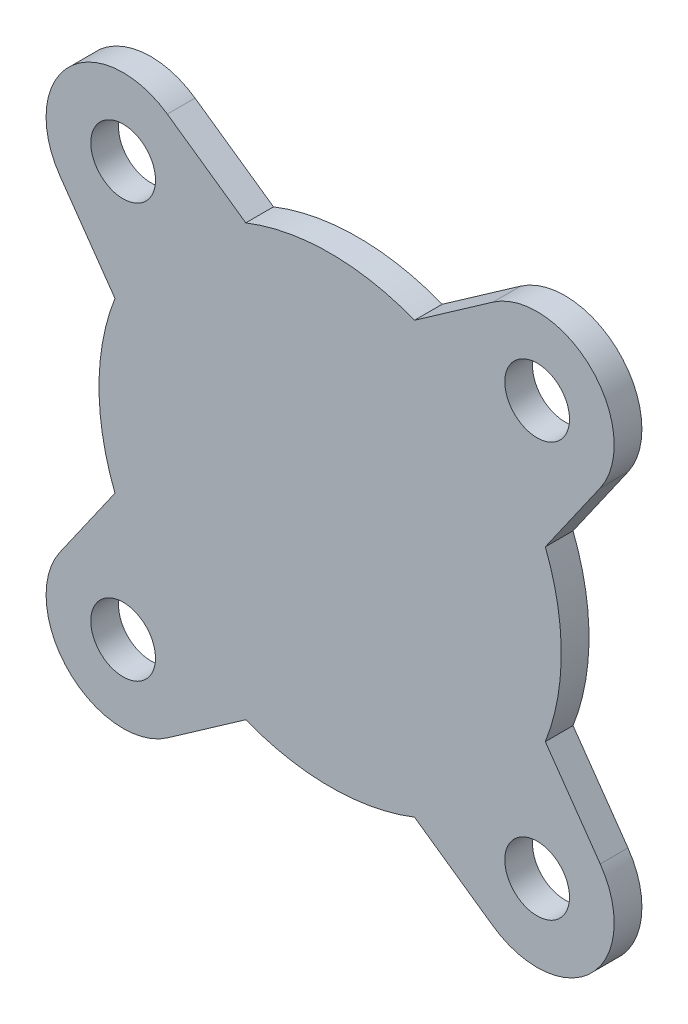
from build123d import *

# Parameters (mm, degrees)
SKETCH_1_R      = 1.05
EXTRUDE_1_DEPTH = 0.9


with BuildPart() as part:
    # Эскиз1 → Бобышка-Вытянуть1 (new body)
    with BuildSketch(Plane.XY):
        with BuildLine():
            ThreePointArc((-6.982577353, 2.73744653), (-7.5, 0), (-6.982577353, -2.73744653))
            Line((-6.982577353, -2.73744653), (-8.765394532, -5.28357333))
            ThreePointArc((-8.765394532, -5.28357333), (-8.485281374, -8.485281374), (-5.28357333, -8.765394532))
            Line((-5.28357333, -8.765394532), (-2.73744653, -6.982577353))
            ThreePointArc((-2.73744653, -6.982577353), (0, -7.5), (2.73744653, -6.982577353))
            Line((2.73744653, -6.982577353), (5.28357333, -8.765394532))
            ThreePointArc((5.28357333, -8.765394532), (8.485281374, -8.485281374), (8.765394532, -5.28357333))
            Line((8.765394532, -5.28357333), (6.982577353, -2.73744653))
            ThreePointArc((6.982577353, -2.73744653), (7.5, 0), (6.982577353, 2.73744653))
            Line((6.982577353, 2.73744653), (8.765394532, 5.28357333))
            ThreePointArc((8.765394532, 5.28357333), (8.485281374, 8.485281374), (5.28357333, 8.765394532))
            Line((5.28357333, 8.765394532), (2.73744653, 6.982577353))
            ThreePointArc((2.73744653, 6.982577353), (0, 7.5), (-2.73744653, 6.982577353))
            Line((-2.73744653, 6.982577353), (-5.28357333, 8.765394532))
            ThreePointArc((-5.28357333, 8.765394532), (-8.485281374, 8.485281374), (-8.765394532, 5.28357333))
            Line((-8.765394532, 5.28357333), (-6.982577353, 2.73744653))
        make_face()
        with Locations((-6.717514421, -6.717514421)):
            Circle(SKETCH_1_R, mode=Mode.SUBTRACT)
        with Locations((6.717514421, -6.717514421)):
            Circle(SKETCH_1_R, mode=Mode.SUBTRACT)
        with Locations((-6.717514421, 6.717514421)):
            Circle(SKETCH_1_R, mode=Mode.SUBTRACT)
        with Locations((6.717514421, 6.717514421)):
            Circle(SKETCH_1_R, mode=Mode.SUBTRACT)
    extrude(amount=EXTRUDE_1_DEPTH)


solid = part.part
